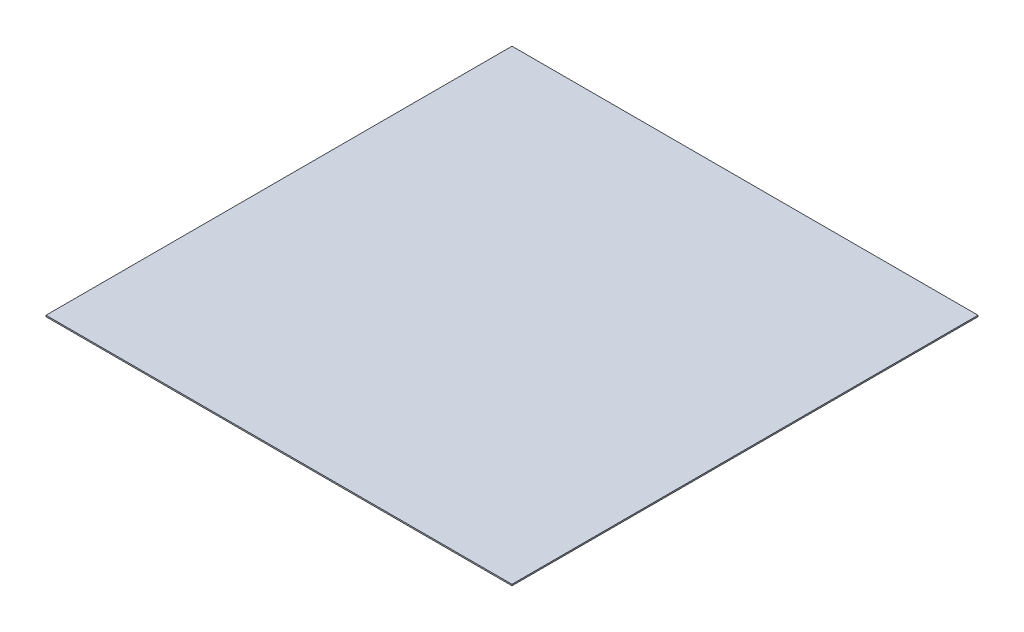
from build123d import *

# Parameters (mm, degrees)
SKETCH_1_W      = 345
SKETCH_1_H      = 345
EXTRUDE_1_DEPTH = 1


with BuildPart() as part:
    # 草图1 → 凸台-拉伸1 (new body)
    with BuildSketch(Plane(origin=(0, 0, 0), x_dir=(1, 0, 0), z_dir=(0, 1, 0))):
        with Locations((172.5, -172.5)):
            Rectangle(SKETCH_1_W, SKETCH_1_H)
    extrude(amount=EXTRUDE_1_DEPTH)


solid = part.part
